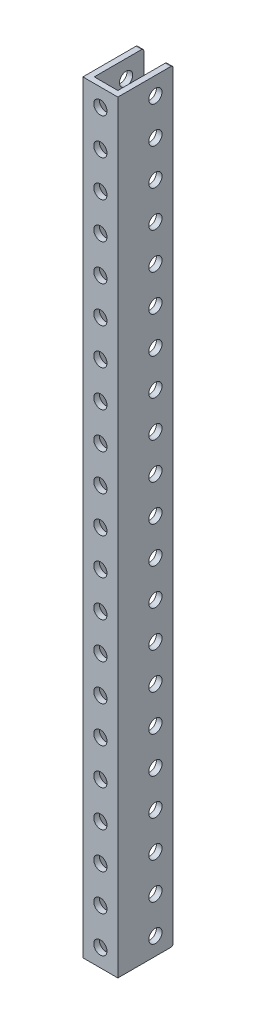
from build123d import *

# Parameters (mm, degrees)
SKETCH1_W                 = 14.859
SKETCH1_H                 = 205.105
BOSS_EXTRUDE1_DEPTH       = 9.398
SKETCH2_W                 = 6.35
SKETCH2_H                 = 13.335
CUT_EXTRUDE1_DEPTH        = 206.591740717
F_5_CLEARANCE_HOLE1_D     = 3.556
F_5_CLEARANCE_HOLE1_DEPTH = 1.524
F_5_CLEARANCE_HOLE2_D     = 3.556
F_5_CLEARANCE_HOLE2_DEPTH = 14.859
F_5_CLEARANCE_HOLE3_D     = 3.556
F_5_CLEARANCE_HOLE3_DEPTH = 9.398
FILLET1_R                 = 0.635


with BuildPart() as part:
    # Sketch1 → Boss-Extrude1 (new body)
    with BuildSketch(Plane(origin=(4.699, 0, 0), x_dir=(0, 0, -1), z_dir=(1, 0, 0))):
        with Locations((5.9055, 102.5525)):
            Rectangle(SKETCH1_W, SKETCH1_H)
    extrude(amount=-BOSS_EXTRUDE1_DEPTH)

    # Sketch2 → Cut-Extrude1 (cut, through all)
    with BuildSketch(Plane.XZ):
        with Locations((0, -6.6675)):
            Rectangle(SKETCH2_W, SKETCH2_H)
    extrude(amount=-CUT_EXTRUDE1_DEPTH, mode=Mode.SUBTRACT)

    # #5 Clearance Hole1
    with Locations(Plane(origin=(-3.175, 0, 0), x_dir=(0, 0, -1), z_dir=(1, 0, 0))):
        with Locations((8.5725, 190.5635), (8.5725, 200.3425), (8.5725, 180.7845), (8.5725, 171.0055), (8.5725, 161.2265), (8.5725, 151.4475), (8.5725, 141.6685), (8.5725, 131.8895), (8.5725, 122.1105), (8.5725, 112.3315), (8.5725, 102.5525), (8.5725, 92.7735), (8.5725, 82.9945), (8.5725, 73.2155), (8.5725, 63.4365), (8.5725, 53.6575), (8.5725, 43.8785), (8.5725, 34.0995), (8.5725, 24.3205), (8.5725, 14.5415), (8.5725, 4.7625)):
            Hole(F_5_CLEARANCE_HOLE1_D / 2, depth=F_5_CLEARANCE_HOLE1_DEPTH)

    # #5 Clearance Hole2
    with Locations(Plane.XY.offset(1.524)):
        with Locations((0, 190.5635), (0, 200.3425), (0, 180.7845), (0, 171.0055), (0, 161.2265), (0, 151.4475), (0, 141.6685), (0, 131.8895), (0, 122.1105), (0, 112.3315), (0, 102.5525), (0, 92.7735), (0, 82.9945), (0, 73.2155), (0, 63.4365), (0, 53.6575), (0, 43.8785), (0, 34.0995), (0, 24.3205), (0, 14.5415), (0, 4.7625)):
            Hole(F_5_CLEARANCE_HOLE2_D / 2, depth=F_5_CLEARANCE_HOLE2_DEPTH)

    # #5 Clearance Hole3
    with Locations(Plane(origin=(4.699, 0, 0), x_dir=(0, 0, -1), z_dir=(1, 0, 0))):
        with Locations((8.5725, 190.5635), (8.5725, 200.3425), (8.5725, 180.7845), (8.5725, 171.0055), (8.5725, 161.2265), (8.5725, 151.4475), (8.5725, 141.6685), (8.5725, 131.8895), (8.5725, 122.1105), (8.5725, 112.3315), (8.5725, 102.5525), (8.5725, 92.7735), (8.5725, 82.9945), (8.5725, 73.2155), (8.5725, 63.4365), (8.5725, 53.6575), (8.5725, 43.8785), (8.5725, 34.0995), (8.5725, 24.3205), (8.5725, 14.5415), (8.5725, 4.7625)):
            Hole(F_5_CLEARANCE_HOLE3_D / 2, depth=F_5_CLEARANCE_HOLE3_DEPTH)

    # Fillet1
    fillet1_edges = [part.edges().sort_by_distance(p)[0] for p in [
        (3.937, 0, -13.335),
        (3.937, 205.105, -13.335),
        (-3.937, 205.105, -13.335),
        (-3.937, 0, -13.335),
    ]]
    fillet(fillet1_edges, radius=FILLET1_R)


solid = part.part
